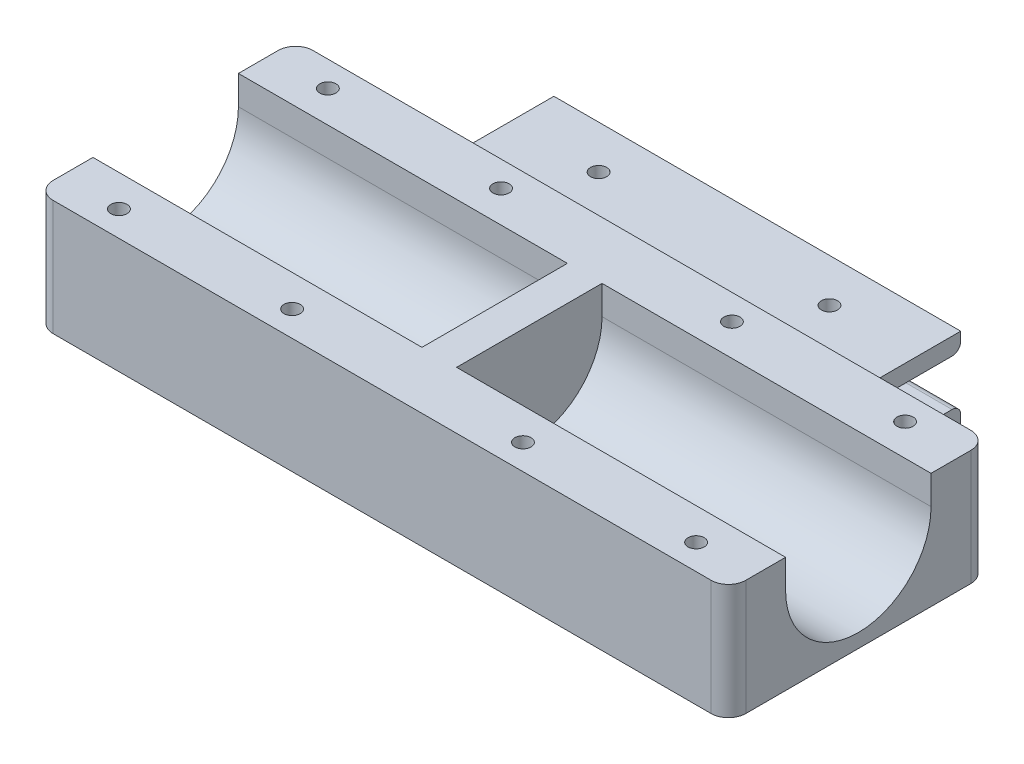
from build123d import *

# Parameters (mm, degrees)
BOSS_EXTRUDE1_DEPTH     = 20
CUT_EXTRUDE1_DEPTH      = 57
CUT_EXTRUDE2_START      = -57
CUT_EXTRUDE2_DEPTH      = 57
SKETCH12_W              = 70.48528137
SKETCH12_H              = 6
CUT_EXTRUDE3_DEPTH      = 20
CUT_EXTRUDE4_DEPTH      = 104.740847077
CUT_EXTRUDE4_DEPTH_BACK = 15
SKETCH12_7_OUTSIDE_W    = 149.586
SKETCH12_7_OUTSIDE_H    = 49.586
SKETCH12_7_OUTSIDE_W_2  = 70.48528137
SKETCH12_7_OUTSIDE_H_2  = 3
SKETCH16_W              = 25.2
SKETCH16_H              = 5
CUT_EXTRUDE8_DEPTH      = 57
SKETCH18_R              = 1.4
CUT_EXTRUDE11_DEPTH     = 10
FILLET2_R               = 1
FILLET3_R               = 1.5
SKETCH20_W              = 25.2
SKETCH20_H              = 5
CUT_EXTRUDE12_DEPTH     = 57
FILLET5_R               = 3
FILLET6_R               = 4
SKETCH21_R              = 1.4
CUT_EXTRUDE13_DEPTH     = 20


with BuildPart() as part:
    # Sketch2 → Boss-Extrude1 (new body)
    with BuildSketch(Plane(origin=(0, 0, 0), x_dir=(1, 0, 0), z_dir=(0, 1, 0))):
        Polygon((-41.659950522, -21.859673837), (-41.659950522, -66.859673837), (78.340049478, -66.859673837), (78.340049478, -21.859673837), (53.582690163, -21.859673837), (53.582690163, -1.859673837), (-16.902591207, -1.859673837), (-16.902591207, -21.859673837), align=None)
    extrude(amount=BOSS_EXTRUDE1_DEPTH)

    # Sketch3 → Cut-Extrude1 (cut)
    with BuildSketch(Plane(origin=(78.340049478, 0, 0), x_dir=(0, 0, -1), z_dir=(1, 0, 0))):
        with BuildLine():
            ThreePointArc((-55.925139673, 20), (-46.912626096, 2.661343883), (-31.759673837, 15))
            ThreePointArc((-31.759673837, 15), (-32.02101772, 17.552952259), (-32.794208001, 20))
            Line((-32.794208001, 20), (-55.925139673, 20))
        make_face()
    extrude(amount=-CUT_EXTRUDE1_DEPTH, mode=Mode.SUBTRACT)

    # Sketch5 → Cut-Extrude2 (cut)
    with BuildSketch(Plane.ZY.offset(41.659950522).offset(CUT_EXTRUDE2_START)):
        with BuildLine():
            ThreePointArc((32.794208001, 20), (41.806721579, 2.661343883), (56.959673837, 15))
            ThreePointArc((56.959673837, 15), (56.698329954, 17.552952259), (55.925139673, 20))
            Line((55.925139673, 20), (32.794208001, 20))
        make_face()
    extrude(amount=CUT_EXTRUDE2_DEPTH, mode=Mode.SUBTRACT)

    # Sketch12 → Cut-Extrude3 (cut)
    with BuildSketch(Plane(origin=(0, 0, 1.859673837), x_dir=(-1, 0, 0), z_dir=(0, 0, -1))):
        with Locations((-18.340049478, 17)):
            Rectangle(SKETCH12_W, SKETCH12_H)
    extrude(amount=-CUT_EXTRUDE3_DEPTH, mode=Mode.SUBTRACT)

    # Sketch12<7> outside → Cut-Extrude4 (cut, two sides: drawn at the far end of the back side and taken through both)
    with BuildSketch(Plane(origin=(0, 0, 1.859673837), x_dir=(-1, 0, 0), z_dir=(0, 0, -1)).offset(-CUT_EXTRUDE4_DEPTH_BACK)):
        with Locations((-18.34, 10)):
            Rectangle(SKETCH12_7_OUTSIDE_W, SKETCH12_7_OUTSIDE_H)
        with Locations((-18.340049478, 1.5)):
            Rectangle(SKETCH12_7_OUTSIDE_W_2, SKETCH12_7_OUTSIDE_H_2, mode=Mode.SUBTRACT)
        with Locations((-18.340049478, 12.5)):
            Rectangle(SKETCH12_7_OUTSIDE_W_2, SKETCH12_7_OUTSIDE_H_2, mode=Mode.SUBTRACT)
    extrude(amount=CUT_EXTRUDE4_DEPTH + CUT_EXTRUDE4_DEPTH_BACK, mode=Mode.SUBTRACT)

    # Sketch16 → Cut-Extrude8 (cut)
    with BuildSketch(Plane.ZY.offset(41.659950522)):
        with Locations((44.359673837, 17.5)):
            Rectangle(SKETCH16_W, SKETCH16_H)
    extrude(amount=-CUT_EXTRUDE8_DEPTH, mode=Mode.SUBTRACT)

    # Sketch18 → Cut-Extrude11 (cut)
    with BuildSketch(Plane(origin=(0, 20, 0), x_dir=(1, 0, 0), z_dir=(0, 1, 0))):
        with Locations((-31.659950522, -26.259673837)):
            Circle(SKETCH18_R)
        with Locations((-1.659950522, -26.259673837)):
            Circle(SKETCH18_R)
        with Locations((-1.659950522, -62.459673837)):
            Circle(SKETCH18_R)
        with Locations((-31.659950522, -62.459673837)):
            Circle(SKETCH18_R)
        with Locations((38.340049478, -62.459673837)):
            Circle(SKETCH18_R)
        with Locations((68.340049478, -62.459673837)):
            Circle(SKETCH18_R)
        with Locations((38.340049478, -26.259673837)):
            Circle(SKETCH18_R)
        with Locations((68.340049478, -26.259673837)):
            Circle(SKETCH18_R)
    extrude(amount=-CUT_EXTRUDE11_DEPTH, mode=Mode.SUBTRACT)

    # Fillet2
    fillet2_edges = [part.edges().sort_by_distance(p)[0] for p in [
        (18.340049478, 3, 16.859673837),
        (18.340049478, 11, 16.859673837),
    ]]
    fillet(fillet2_edges, radius=FILLET2_R)

    # Fillet3
    fillet3_edges = [part.edges().sort_by_distance(p)[0] for p in [
        (18.340049478, 3, 1.859673837),
        (18.340049478, 11, 1.859673837),
    ]]
    fillet(fillet3_edges, radius=FILLET3_R)

    # Sketch20 → Cut-Extrude12 (cut)
    with BuildSketch(Plane(origin=(78.340049478, 0, 0), x_dir=(0, 0, -1), z_dir=(1, 0, 0))):
        with Locations((-44.359673837, 17.5)):
            Rectangle(SKETCH20_W, SKETCH20_H)
    extrude(amount=-CUT_EXTRUDE12_DEPTH, mode=Mode.SUBTRACT)

    # Fillet5
    fillet5_edges = [part.edges().sort_by_distance(p)[0] for p in [
        (78.340049478, 10, 66.859673837),
        (78.340049478, 10, 21.859673837),
        (-41.659950522, 10, 21.859673837),
        (-41.659950522, 10, 66.859673837),
    ]]
    fillet(fillet5_edges, radius=FILLET5_R)

    # Fillet6
    fillet6_edges = [part.edges().sort_by_distance(p)[0] for p in [
        (53.582690163, 7, 21.859673837),
        (-16.902591207, 7, 21.859673837),
        (18.340049478, 14, 21.859673837),
    ]]
    fillet(fillet6_edges, radius=FILLET6_R)

    # Sketch21 → Cut-Extrude13 (cut)
    with BuildSketch(Plane(origin=(0, 14, 0), x_dir=(1, 0, 0), z_dir=(0, 1, 0))):
        with Locations((38.340049478, -9.359673837)):
            Circle(SKETCH21_R)
        with Locations((-1.659950522, -9.359673837)):
            Circle(SKETCH21_R)
    extrude(amount=-CUT_EXTRUDE13_DEPTH, mode=Mode.SUBTRACT)


solid = part.part
